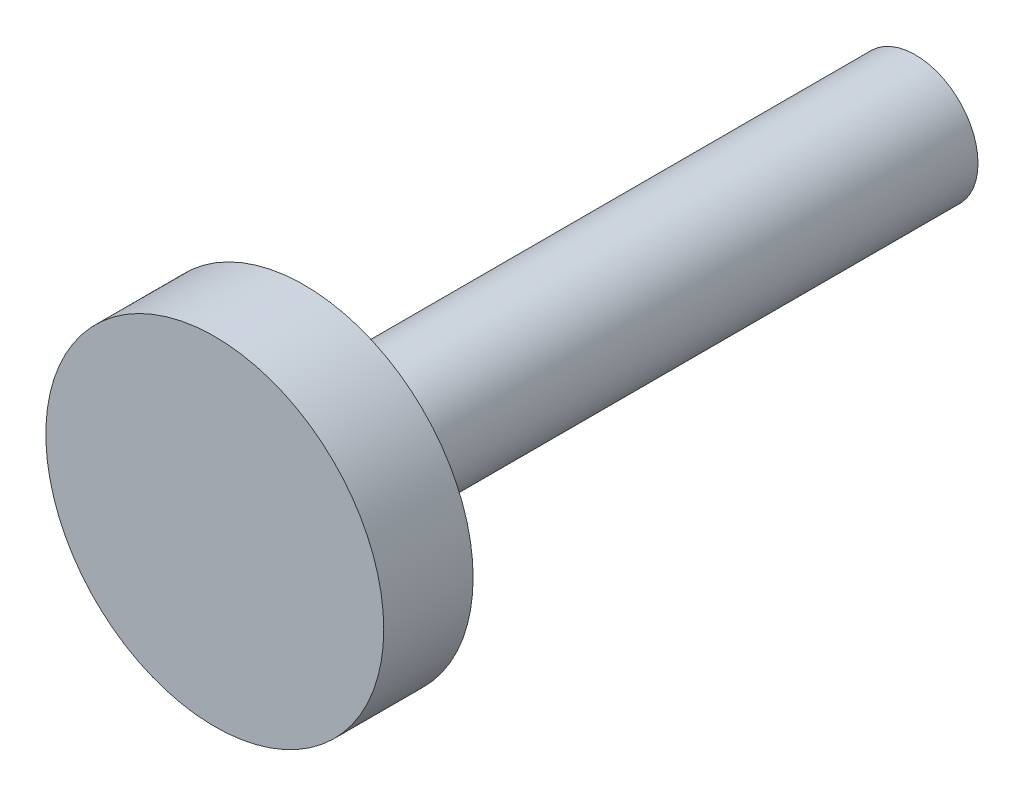
from build123d import *

# Parameters (mm, degrees)
SKETCH1_R           = 3.5
BOSS_EXTRUDE1_DEPTH = 34.2
SKETCH2_R           = 9.45299319
BOSS_EXTRUDE2_DEPTH = 5
CUT_EXTRUDE1_DEPTH  = 1.92
SKETCH4_R           = 1
CUT_EXTRUDE2_DEPTH  = 10


with BuildPart() as part:
    # Sketch1 → Boss-Extrude1 (new body)
    with BuildSketch(Plane.XY):
        Circle(SKETCH1_R)
    extrude(amount=BOSS_EXTRUDE1_DEPTH)

    # Sketch2 → Boss-Extrude2 (add)
    with BuildSketch(Plane.XY.offset(34.2)):
        Circle(SKETCH2_R)
    extrude(amount=BOSS_EXTRUDE2_DEPTH)

    # Sketch3 → Cut-Extrude1 (cut)
    with BuildSketch(Plane(origin=(0, 0, 0), x_dir=(-1, 0, 0), z_dir=(0, 0, -1))):
        Polygon((-1.943409889, 1.572627739), (-2.333640517, -0.896728464), (-0.390230628, -2.469356203), (1.943409889, -1.572627739), (2.333640517, 0.896728464), (0.390230628, 2.469356203), align=None)
    extrude(amount=-CUT_EXTRUDE1_DEPTH, mode=Mode.SUBTRACT)

    # Sketch4 → Cut-Extrude2 (cut)
    with BuildSketch(Plane(origin=(0, 0, 1.92), x_dir=(-1, 0, 0), z_dir=(0, 0, -1))):
        Circle(SKETCH4_R)
    extrude(amount=-CUT_EXTRUDE2_DEPTH, mode=Mode.SUBTRACT)


solid = part.part
